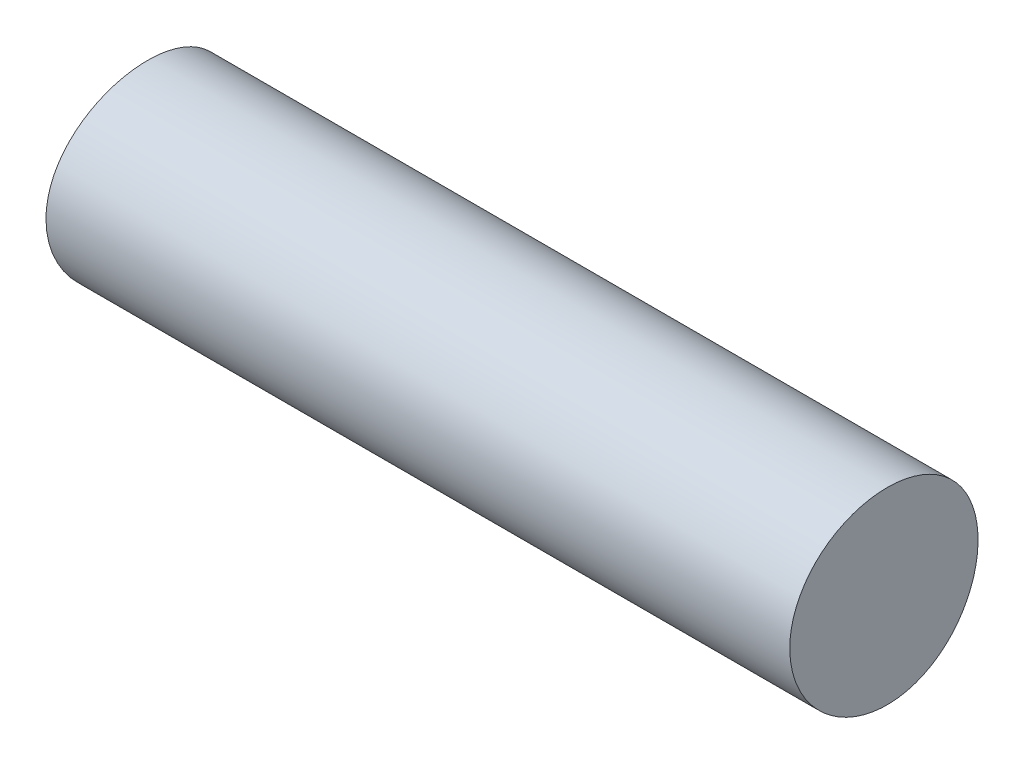
from build123d import *

# Parameters (mm, degrees)
SKETCH1_R           = 50
SKETCH1_R_2         = 22.5
BOSS_EXTRUDE6_DEPTH = 10
SKETCH2_R           = 3.5
BOSS_EXTRUDE7_DEPTH = 100


with BuildPart() as part:
    # Sketch1 → Boss-Extrude6 (new body)
    with BuildSketch(Plane(origin=(0, 0, 0), x_dir=(1, 0, 0), z_dir=(0, 1, 0))):
        Circle(SKETCH1_R)
        Circle(SKETCH1_R_2, mode=Mode.SUBTRACT)
    extrude(amount=BOSS_EXTRUDE6_DEPTH)


with BuildPart() as body_2:
    # Sketch2 → Boss-Extrude7 (new body)
    with BuildSketch(Plane(origin=(10, 0, 0), x_dir=(0, 0, -1), z_dir=(1, 0, 0))):
        with Locations((0, 4.904618841)):
            Circle(SKETCH2_R)
    extrude(amount=BOSS_EXTRUDE7_DEPTH)


with BuildPart() as part_1:
    add(part.part)

    # Combine1: intersect body 2
    add(body_2.part, mode=Mode.INTERSECT)


solid = part_1.part
